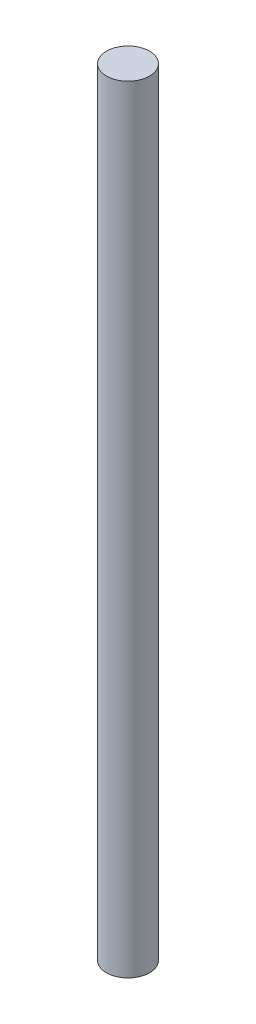
from build123d import *

# Parameters (mm, degrees)
SKETCH2_R           = 5
BOSS_EXTRUDE1_DEPTH = 180


with BuildPart() as part:
    # Sketch2 → Boss-Extrude1 (new body)
    with BuildSketch(Plane(origin=(0, 0, 0), x_dir=(1, 0, 0), z_dir=(0, 1, 0))):
        with Locations(Location((0, 0, 0), (0, 0, 90))):
            Circle(SKETCH2_R)
    extrude(amount=BOSS_EXTRUDE1_DEPTH)


solid = part.part
